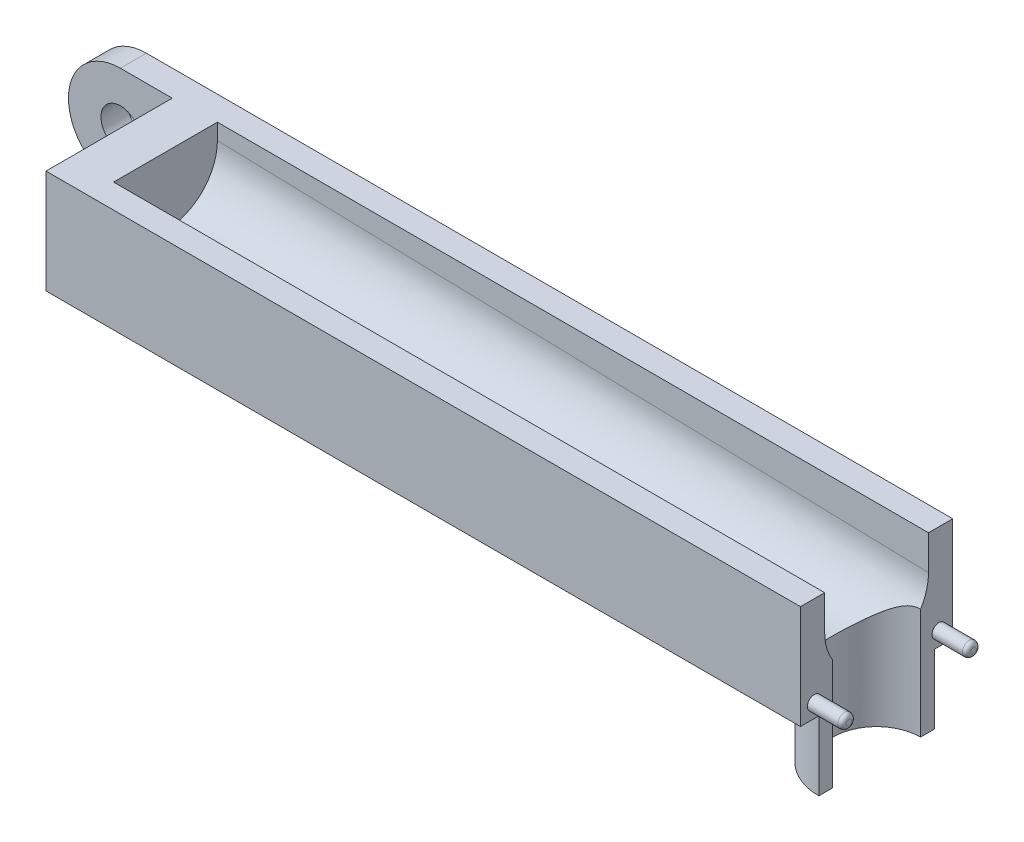
from build123d import *

# Parameters (mm, degrees)
SKETCH1_W           = 27.94
SKETCH1_H           = 19.05
BOSS_EXTRUDE1_DEPTH = 138.4173
SKETCH5_R           = 3.556
BOSS_EXTRUDE2_DEPTH = 4.7752
SKETCH6_R           = 10.6045
SKETCH6_R_2         = 8.0645
BOSS_EXTRUDE3_DEPTH = 12.7
SKETCH8_R           = 8.0645
CUT_EXTRUDE2_DEPTH  = 151.882604283
SKETCH9_W           = 32.717360996
SKETCH9_H           = 24.765
CUT_EXTRUDE3_DEPTH  = 151.882604283
SKETCH10_R          = 1.27
BOSS_EXTRUDE4_DEPTH = 6.35
FILLET1_R           = 0.762


with BuildPart() as part:
    # Sketch1 → Boss-Extrude1 (new body)
    with BuildSketch(Plane(origin=(0, 0, 0), x_dir=(0, 0, -1), z_dir=(1, 0, 0))):
        Rectangle(SKETCH1_W, SKETCH1_H)
    extrude(amount=BOSS_EXTRUDE1_DEPTH)

    # Cut-Sweep1: sweep along a path in Sketch3
    with BuildLine(Plane.XY) as cut_sweep1_path:
        Line((138.4173, 9.525), (7.9502, 12.941401248))
    # Sketch2 → Cut-Sweep1 (sweep, cut)
    with BuildSketch(Plane(origin=(138.4173, 0, 0), x_dir=(0, 0, -1), z_dir=(1, 0, 0))):
        with BuildLine():
            Line((-9.525, 3.175), (-9.525, 9.525))
            Line((-9.525, 9.525), (9.525, 9.525))
            Line((9.525, 9.525), (9.525, 3.175))
            ThreePointArc((9.525, 3.175), (0, -6.35), (-9.525, 3.175))
        make_face()
    sweep(path=cut_sweep1_path.line, mode=Mode.SUBTRACT)

    # Sketch5 → Boss-Extrude2 (add)
    with BuildSketch(Plane(origin=(0, 0, -13.97), x_dir=(-1, 0, 0), z_dir=(0, 0, -1))):
        with BuildLine():
            Line((0, -9.525), (0, 9.525))
            Line((0, 9.525), (9.525, 9.525))
            ThreePointArc((9.525, 9.525), (19.05, 0), (9.525, -9.525))
            Line((9.525, -9.525), (0, -9.525))
        make_face()
        with Locations((9.525, 0)):
            Circle(SKETCH5_R, mode=Mode.SUBTRACT)
    extrude(amount=-BOSS_EXTRUDE2_DEPTH)

    # Sketch6 → Boss-Extrude3 (add)
    with BuildSketch(Plane.XZ.offset(9.525)):
        with Locations(Location((138.4173, 0, 0), (0, 0, 270))):
            Circle(SKETCH6_R)
        with Locations(Location((138.4173, 0, 0), (0, 0, 270))):
            Circle(SKETCH6_R_2, mode=Mode.SUBTRACT)
    extrude(amount=BOSS_EXTRUDE3_DEPTH)

    # Sketch8 → Cut-Extrude2 (cut, through all)
    with BuildSketch(Plane.XZ.offset(9.525)):
        with Locations(Location((138.4173, 0, 0), (0, 0, 270))):
            Circle(SKETCH8_R)
    extrude(amount=-CUT_EXTRUDE2_DEPTH, mode=Mode.SUBTRACT)

    # Sketch9 → Cut-Extrude3 (cut, through all)
    with BuildSketch(Plane.XZ.offset(9.525)):
        with Locations((154.775980498, 1.5875)):
            Rectangle(SKETCH9_W, SKETCH9_H)
    extrude(amount=CUT_EXTRUDE3_DEPTH, mode=Mode.SUBTRACT)

    # Sketch10 → Boss-Extrude4 (add)
    with BuildSketch(Plane(origin=(138.4173, 0, 0), x_dir=(0, 0, -1), z_dir=(1, 0, 0))):
        with Locations(Location((-11.43, -6.985, 0), (0, 0, 180))):
            Circle(SKETCH10_R)
        with Locations(Location((11.43, -6.985, 0), (0, 0, 180))):
            Circle(SKETCH10_R)
    extrude(amount=BOSS_EXTRUDE4_DEPTH)

    # Fillet1
    fillet1_edges = [part.edges().sort_by_distance(p)[0] for p in [
        (144.7673, -6.985, 10.16),
        (144.7673, -6.985, -12.7),
    ]]
    fillet(fillet1_edges, radius=FILLET1_R)


solid = part.part
